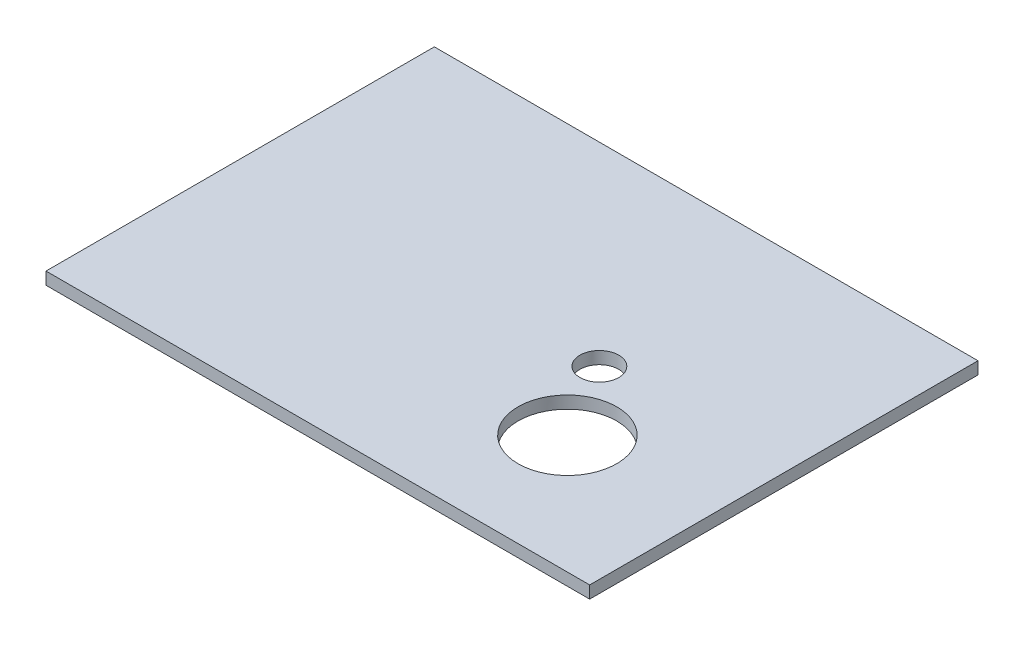
from build123d import *

# Parameters (mm, degrees)
SKETCH1_W           = 140
SKETCH1_H           = 100
BOSS_EXTRUDE1_DEPTH = 3.175
SKETCH2_R           = 12.705
SKETCH2_R_2         = 5
CUT_EXTRUDE1_DEPTH  = 10


with BuildPart() as part:
    # Sketch1 → Boss-Extrude1 (new body)
    with BuildSketch(Plane(origin=(0, 0, 0), x_dir=(1, 0, 0), z_dir=(0, 1, 0))):
        with Locations((70, 50)):
            Rectangle(SKETCH1_W, SKETCH1_H)
    extrude(amount=BOSS_EXTRUDE1_DEPTH)

    # Sketch2 → Cut-Extrude1 (cut)
    with BuildSketch(Plane(origin=(0, 3.175, 0), x_dir=(1, 0, 0), z_dir=(0, 1, 0))):
        with Locations(Location((103.75, 30.514428415, 0), (0, 0, 270))):
            Circle(SKETCH2_R)
        with Locations(Location((92.5, 50, 0), (0, 0, 270))):
            Circle(SKETCH2_R_2)
    extrude(amount=-CUT_EXTRUDE1_DEPTH, mode=Mode.SUBTRACT)


solid = part.part
